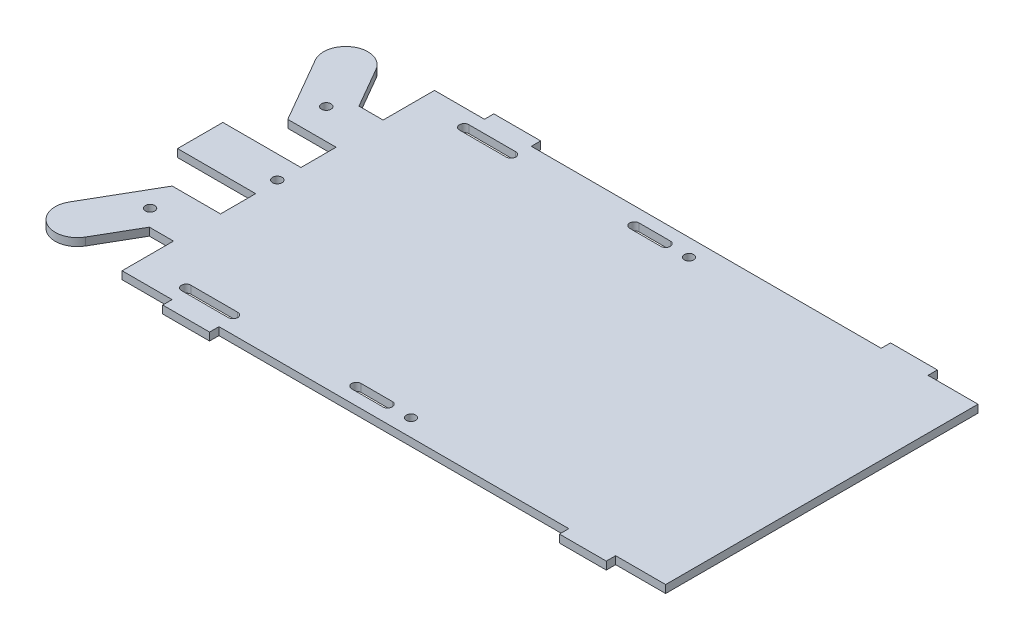
from build123d import *

# Parameters (mm, degrees)
BOSS_EXTRUDE1_DEPTH = 2.5
SKETCH2_W           = 15
SKETCH2_H           = 2.5
BOSS_EXTRUDE2_DEPTH = 3
SKETCH5_R           = 1.524
BOSS_EXTRUDE4_DEPTH = 2.5
SKETCH6_R           = 1.524
CUT_EXTRUDE1_DEPTH  = 2.5
SKETCH7_R           = 1.5
CUT_EXTRUDE2_DEPTH  = 2.5


with BuildPart() as part:
    # Sketch1 → Boss-Extrude1 (new body)
    with BuildSketch(Plane(origin=(0, 0, 0), x_dir=(1, 0, 0), z_dir=(0, 1, 0))):
        Polygon((-87, -50), (-87, -7.25), (-112, -7.25), (-112, 7.25), (-87, 7.25), (-87, 50), (87, 50), (87, -50), align=None)
    extrude(amount=BOSS_EXTRUDE1_DEPTH)

    # Sketch2 → Boss-Extrude2 (add)
    with BuildSketch(Plane.XY.offset(50)):
        with Locations((-63.5, 1.25)):
            Rectangle(SKETCH2_W, SKETCH2_H)
        with Locations((63.5, 1.25)):
            Rectangle(SKETCH2_W, SKETCH2_H)
    boss_extrude2 = extrude(amount=BOSS_EXTRUDE2_DEPTH)

    # Mirror1: Boss-Extrude2 across plane
    add(boss_extrude2.mirror(Plane.XY))

    # Sketch5 → Boss-Extrude4 (add)
    with BuildSketch(Plane(origin=(0, 2.5, 0), x_dir=(1, 0, 0), z_dir=(0, 1, 0))):
        with BuildLine():
            Line((-102.204774668, -46.50231683), (-94.729060006, -33.553999212))
            Line((-94.729060006, -33.553999212), (-87, -33.553999212))
            Line((-87, -33.553999212), (-87, -18.493123836))
            Line((-87, -18.493123836), (-102.458120011, -18.493123836))
            Line((-102.458120011, -18.493123836), (-114.523120011, -39.39031683))
            ThreePointArc((-114.523120011, -39.39031683), (-111.919947339, -49.105489501), (-102.204774668, -46.50231683))
        make_face()
        with Locations(Location((-99.854947339, -28.208296508, 0), (0, 0, 270))):
            Circle(SKETCH5_R, mode=Mode.SUBTRACT)
    boss_extrude4 = extrude(amount=-BOSS_EXTRUDE4_DEPTH)

    # Sketch6 → Cut-Extrude1 (cut)
    with BuildSketch(Plane.XZ):
        with Locations(Location((-87.318751132, 0, 0), (0, 0, 270))):
            Circle(SKETCH6_R)
    extrude(amount=-CUT_EXTRUDE1_DEPTH, mode=Mode.SUBTRACT)

    # Mirror2: Boss-Extrude4 across plane
    add(boss_extrude4.mirror(Plane.XY))

    # Sketch7 → Cut-Extrude2 (cut)
    with BuildSketch(Plane(origin=(0, 2.5, 0), x_dir=(1, 0, 0), z_dir=(0, 1, 0))):
        with BuildLine():
            ThreePointArc((-57, -43), (-55.5, -44.5), (-57, -46))
            Line((-57, -46), (-72, -46))
            ThreePointArc((-72, -46), (-73.5, -44.5), (-72, -43))
            Line((-72, -43), (-57, -43))
        make_face()
        with BuildLine():
            Line((-17.5, -46), (-7.5, -46))
            ThreePointArc((-7.5, -46), (-6, -44.5), (-7.5, -43))
            Line((-7.5, -43), (-17.5, -43))
            ThreePointArc((-17.5, -43), (-19, -44.5), (-17.5, -46))
        make_face()
        with BuildLine():
            Line((-72, 43), (-57, 43))
            ThreePointArc((-57, 43), (-55.5, 44.5), (-57, 46))
            Line((-57, 46), (-72, 46))
            ThreePointArc((-72, 46), (-73.5, 44.5), (-72, 43))
        make_face()
        with BuildLine():
            ThreePointArc((-7.5, 46), (-6, 44.5), (-7.5, 43))
            Line((-7.5, 43), (-17.5, 43))
            ThreePointArc((-17.5, 43), (-19, 44.5), (-17.5, 46))
            Line((-17.5, 46), (-7.5, 46))
        make_face()
        with Locations(Location((0, 44.5, 0), (0, 0, 270))):
            Circle(SKETCH7_R)
        with Locations(Location((0, -44.5, 0), (0, 0, 270))):
            Circle(SKETCH7_R)
    extrude(amount=-CUT_EXTRUDE2_DEPTH, mode=Mode.SUBTRACT)


solid = part.part
